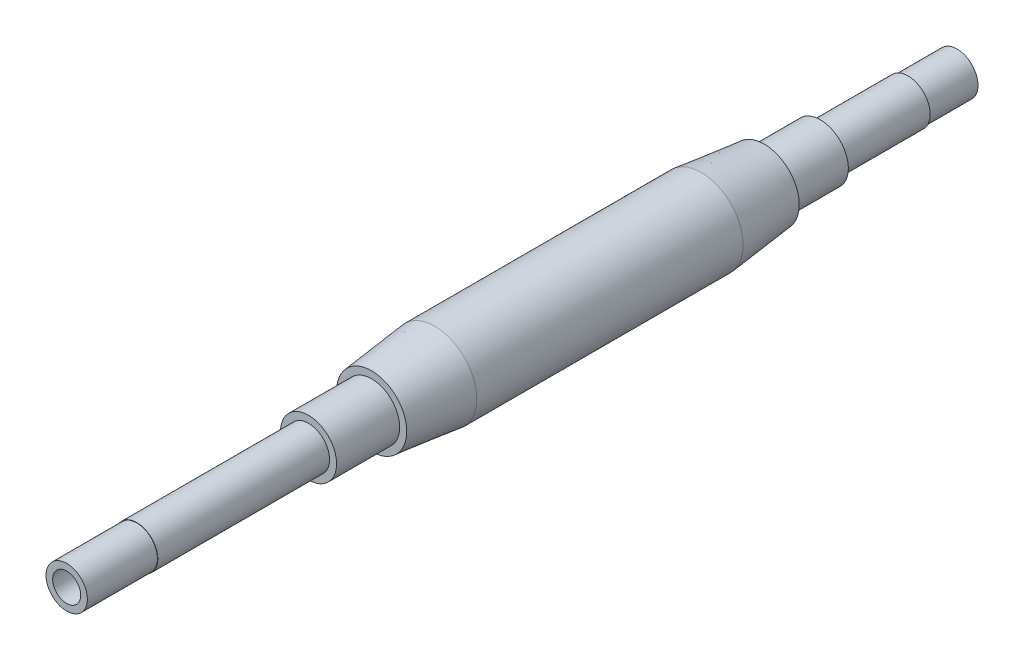
from build123d import *

# Parameters (mm, degrees)
F_4_0_4_DIAMETER_HOLE1_D = 4


with BuildPart() as part:
    # Sketch1 → Revolve1 (revolve)
    with BuildSketch(Plane(origin=(0, 0, 0), x_dir=(0, 0, -1), z_dir=(1, 0, 0)), mode=Mode.PRIVATE) as revolve1_sk:
        Polygon((0, 0), (0, 3), (-7, 3), (-7, 3.175), (-19.5, 3.175), (-19.5, 4), (-27.5, 4), (-27.5, 5), (-36.5, 6), (-74.5, 6), (-83.5, 5), (-83.5, 4), (-92.5, 4), (-92.5, 3), (-117, 3), (-117, 2.95), (-127, 2.95), (-127, 0), align=None)
    revolve(revolve1_sk.sketch.rotate(Axis((0, 0, 0), (0, 0, 1)), 90), axis=Axis((0, 0, 0), (0, 0, 1)))

    # Ø4.0 (4) Diameter Hole1 (through all)
    with Locations(Plane(origin=(0, 0, 0), x_dir=(-1, 0, 0), z_dir=(0, 0, -1))):
        with Locations((0, 0)):
            Hole(F_4_0_4_DIAMETER_HOLE1_D / 2)


solid = part.part
